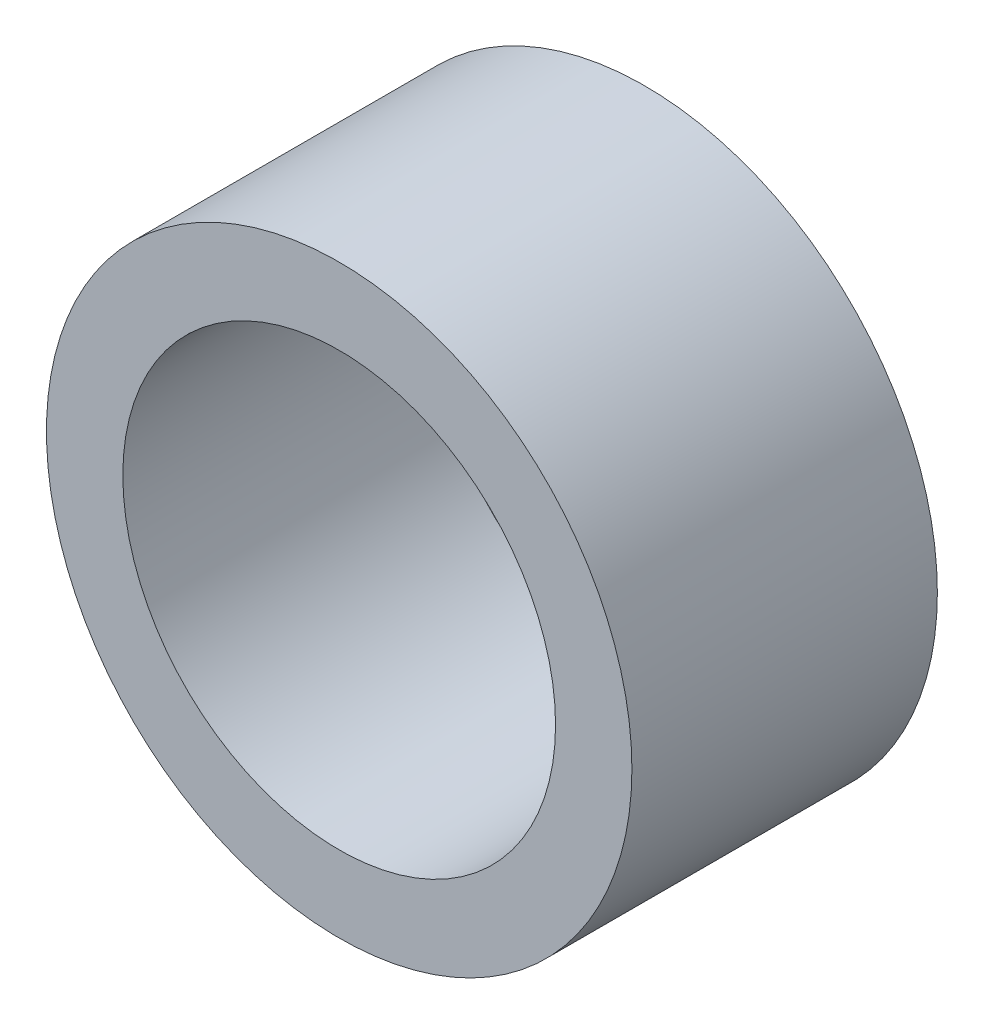
from build123d import *

# Parameters (mm, degrees)
NEEDLE_BEARING_START = 40.5
SKETCH_1_R           = 11.5
SKETCH_1_R_2         = 8.5
NEEDLE_BEARING_DEPTH = 12


with BuildPart() as part:
    # Эскиз1 → Needle_bearing (new body)
    with BuildSketch(Plane.XY.offset(NEEDLE_BEARING_START)):
        Circle(SKETCH_1_R)
        Circle(SKETCH_1_R_2, mode=Mode.SUBTRACT)
    extrude(amount=NEEDLE_BEARING_DEPTH)


solid = part.part
